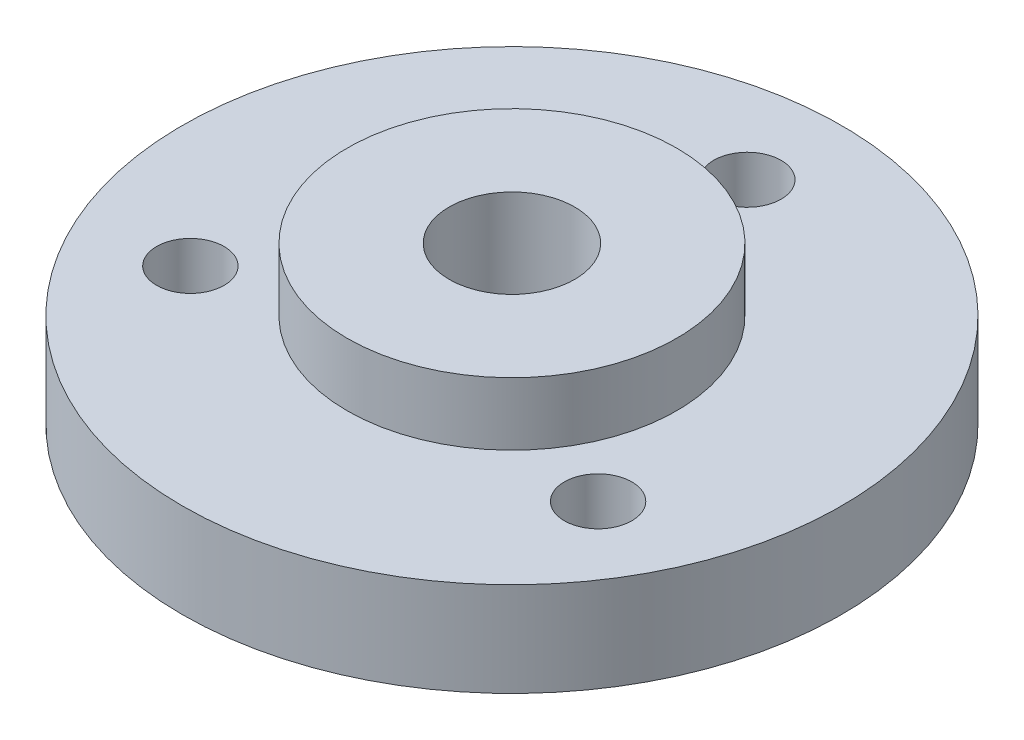
from build123d import *

# Parameters (mm, degrees)
SKETCH1_R           = 21
SKETCH1_R_2         = 4
SKETCH1_R_3         = 2.15
BOSS_EXTRUDE1_DEPTH = 6
SKETCH2_R           = 10.5
SKETCH2_R_2         = 4
BOSS_EXTRUDE2_DEPTH = 4


with BuildPart() as part:
    # Sketch1 → Boss-Extrude1 (new body)
    with BuildSketch(Plane(origin=(0, 0, 0), x_dir=(1, 0, 0), z_dir=(0, 1, 0))):
        with Locations(Location((0, 0, 0), (0, 0, 270))):
            Circle(SKETCH1_R)
        with Locations(Location((0, 0, 0), (0, 0, 270))):
            Circle(SKETCH1_R_2, mode=Mode.SUBTRACT)
        with Locations(Location((0, 15, 0), (0, 0, 270))):
            Circle(SKETCH1_R_3, mode=Mode.SUBTRACT)
        with Locations(Location((12.990381057, -7.5, 0), (0, 0, 270))):
            Circle(SKETCH1_R_3, mode=Mode.SUBTRACT)
        with Locations(Location((-12.990381057, -7.5, 0), (0, 0, 270))):
            Circle(SKETCH1_R_3, mode=Mode.SUBTRACT)
    extrude(amount=BOSS_EXTRUDE1_DEPTH)

    # Sketch2 → Boss-Extrude2 (add)
    with BuildSketch(Plane(origin=(0, 6, 0), x_dir=(1, 0, 0), z_dir=(0, 1, 0))):
        with Locations(Location((0, 0, 0), (0, 0, 270))):
            Circle(SKETCH2_R)
        with Locations(Location((0, 0, 0), (0, 0, 270))):
            Circle(SKETCH2_R_2, mode=Mode.SUBTRACT)
    extrude(amount=BOSS_EXTRUDE2_DEPTH)


solid = part.part
